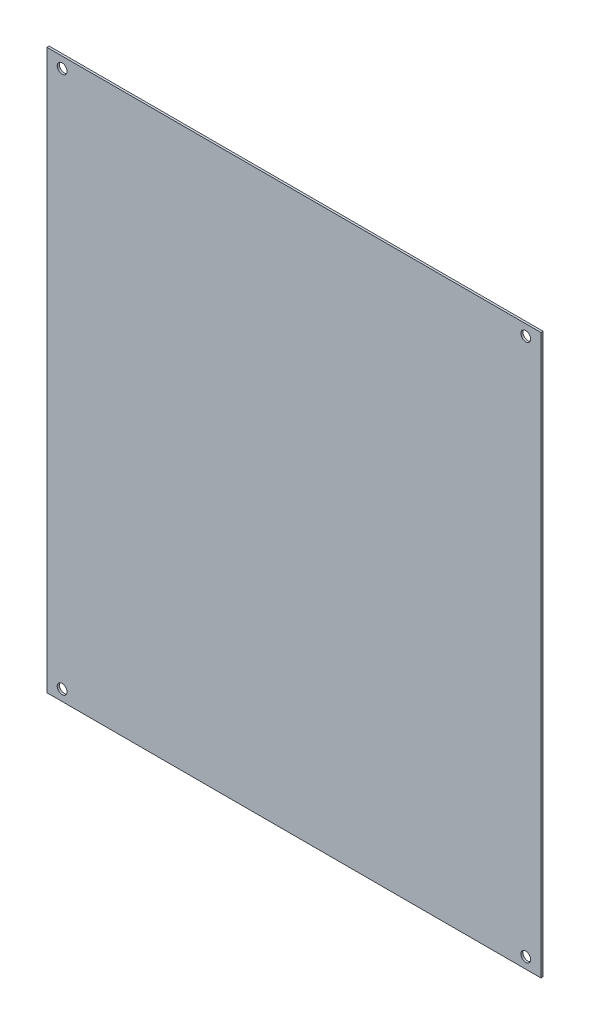
from build123d import *

# Parameters (mm, degrees)
SKETCH_1_W      = 228
SKETCH_1_H      = 258
SKETCH_1_R      = 2.25
EXTRUDE_1_DEPTH = 1


with BuildPart() as part:
    # Эскиз1 → Вытянуть1 (new body)
    with BuildSketch(Plane.XY):
        Rectangle(SKETCH_1_W, SKETCH_1_H)
        with Locations((-107, 124)):
            Circle(SKETCH_1_R, mode=Mode.SUBTRACT)
        with Locations((107, 124)):
            Circle(SKETCH_1_R, mode=Mode.SUBTRACT)
        with Locations(Location((107, -124, 0), (0, 0, 180))):
            Circle(SKETCH_1_R, mode=Mode.SUBTRACT)
        with Locations(Location((-107, -124, 0), (0, 0, 180))):
            Circle(SKETCH_1_R, mode=Mode.SUBTRACT)
    extrude(amount=EXTRUDE_1_DEPTH)


solid = part.part
